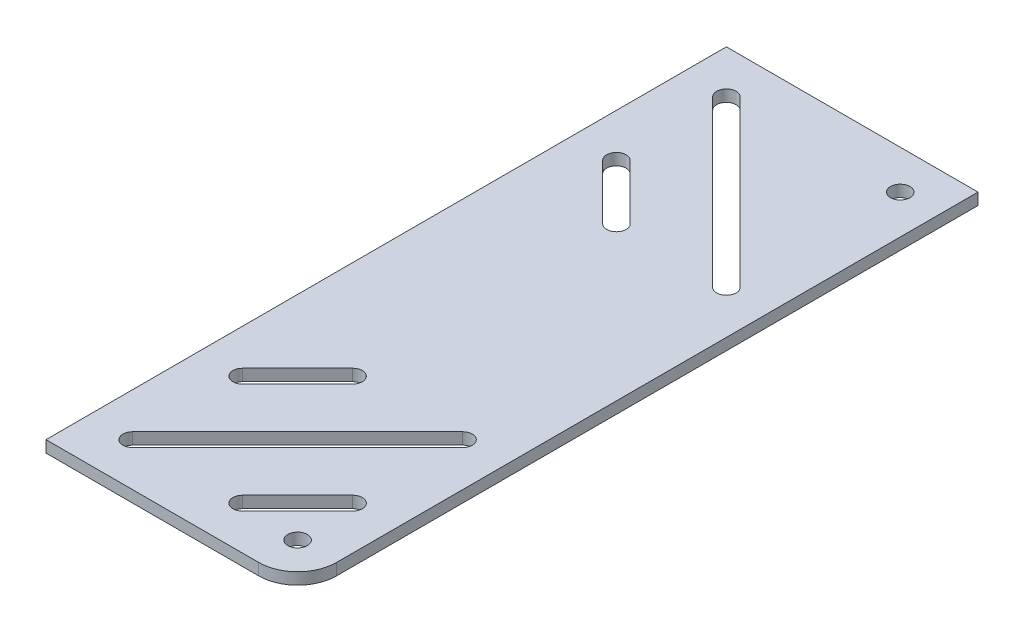
from build123d import *

# Parameters (mm, degrees)
ESQUISSE1_R             = 2.5
BOSS_EXTRU_1_DEPTH      = 3
ENL_V_MAT_EXTRU_1_DEPTH = 210.585226303


with BuildPart() as part:
    # Esquisse1 → Boss.-Extru.1 (new body)
    with BuildSketch(Plane(origin=(0, 0, 0), x_dir=(1, 0, 0), z_dir=(0, 1, 0))):
        with BuildLine():
            Line((125.70871342, 87.5), (180.42247001, 87.5))
            Line((180.42247001, 87.5), (190.42247001, 87.5))
            Line((190.42247001, 87.5), (190.42247001, 77.5))
            Line((190.42247001, 77.5), (190.42247001, -77.5))
            ThreePointArc((190.42247001, -77.5), (187.493537821, -84.571067812), (180.42247001, -87.5))
            Line((180.42247001, -87.5), (125.70871342, -87.5))
            Line((125.70871342, -87.5), (125.70871342, 87.5))
        make_face()
        with Locations(Location((180.42247001, 77.5, 0), (0, 0, 270))):
            Circle(ESQUISSE1_R, mode=Mode.SUBTRACT)
        with Locations(Location((180.42247001, -77.5, 0), (0, 0, 270))):
            Circle(ESQUISSE1_R, mode=Mode.SUBTRACT)
    extrude(amount=BOSS_EXTRU_1_DEPTH)

    # Esquisse2 → Enlèv. mat.-Extru.1 (cut, through all)
    with BuildSketch(Plane(origin=(0, 3, 0), x_dir=(1, 0, 0), z_dir=(0, 1, 0))):
        with BuildLine():
            Line((138.620155232, -78.124092094), (181.046562103, -35.697685223))
            ThreePointArc((181.046562103, -35.697685223), (181.046562103, -32.162151317), (177.511028197, -32.162151317))
            Line((177.511028197, -32.162151317), (135.084621326, -74.588558188))
            ThreePointArc((135.084621326, -74.588558188), (135.084621326, -78.124092094), (138.620155232, -78.124092094))
        make_face()
        with BuildLine():
            Line((166.90442648, -78.124092094), (181.046562103, -63.98195647))
            ThreePointArc((181.046562103, -63.98195647), (181.046562103, -60.446422564), (177.511028197, -60.446422564))
            Line((177.511028197, -60.446422564), (163.368892574, -74.588558188))
            ThreePointArc((163.368892574, -74.588558188), (163.368892574, -78.124092094), (166.90442648, -78.124092094))
        make_face()
        with BuildLine():
            Line((138.620155232, -49.839820846), (152.762290856, -35.697685223))
            ThreePointArc((152.762290856, -35.697685223), (152.762290856, -32.162151317), (149.22675695, -32.162151317))
            Line((149.22675695, -32.162151317), (135.084621326, -46.30428694))
            ThreePointArc((135.084621326, -46.30428694), (135.084621326, -49.839820846), (138.620155232, -49.839820846))
        make_face()
        with BuildLine():
            Line((135.084621326, 74.588558188), (177.511028197, 32.162151317))
            ThreePointArc((177.511028197, 32.162151317), (181.046562103, 32.162151317), (181.046562103, 35.697685223))
            Line((181.046562103, 35.697685223), (138.620155232, 78.124092094))
            ThreePointArc((138.620155232, 78.124092094), (135.084621326, 78.124092094), (135.084621326, 74.588558188))
        make_face()
        with BuildLine():
            Line((135.084621326, 46.30428694), (149.22675695, 32.162151317))
            ThreePointArc((149.22675695, 32.162151317), (152.762290856, 32.162151317), (152.762290856, 35.697685223))
            Line((152.762290856, 35.697685223), (138.620155232, 49.839820846))
            ThreePointArc((138.620155232, 49.839820846), (135.084621326, 49.839820846), (135.084621326, 46.30428694))
        make_face()
    extrude(amount=-ENL_V_MAT_EXTRU_1_DEPTH, mode=Mode.SUBTRACT)


solid = part.part
